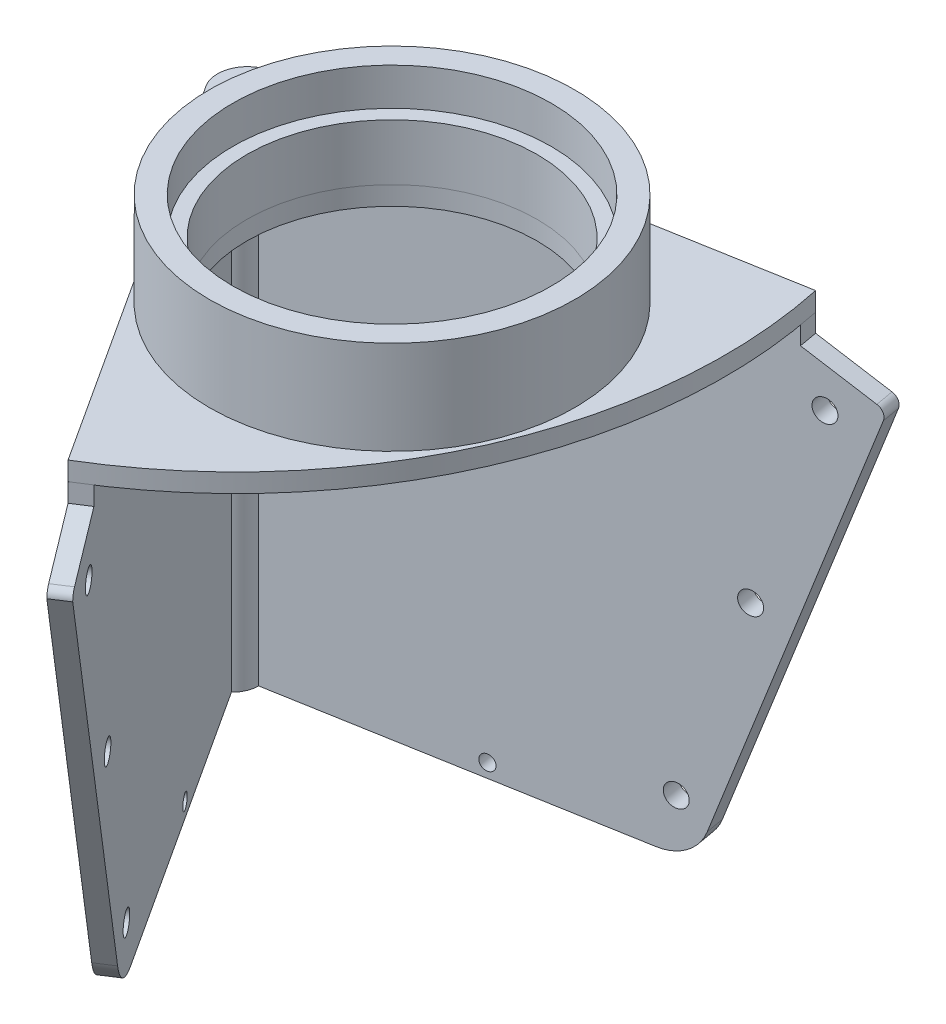
from build123d import *

# Parameters (mm, degrees)
SKETCH1_R           = 0.6
SKETCH1_R_2         = 0.4
BOSS_EXTRUDE2_DEPTH = 1
BOSS_EXTRUDE3_DEPTH = 26.85
SKETCH3_R           = 0.6
SKETCH3_R_2         = 0.4
BOSS_EXTRUDE4_DEPTH = 1
BOSS_EXTRUDE5_DEPTH = 1
SKETCH5_R           = 9.75
SKETCH5_R_2         = 8.5
BOSS_EXTRUDE6_DEPTH = 5
SKETCH5_3_R         = 8.5
SKETCH5_3_R_2       = 7.75
BOSS_EXTRUDE7_DEPTH = 3
CUT_EXTRUDE1_DEPTH  = 3


with BuildPart() as part:
    # Sketch1 → Boss-Extrude2 (new body)
    with BuildSketch(Plane(origin=(3.159090075, 0, 17.916090109), x_dir=(-0.9848077530122081, 0, 0.17364817766693075), z_dir=(-0.17364817766693075, 0, -0.9848077530122081))):
        with BuildLine():
            Line((72.595007279, -13.558180283), (90.945658345, -13.558180283))
            Line((90.945658345, -13.558180283), (90.945658345, -12.058180283))
            Line((90.945658345, -12.058180283), (90.945658345, 13.327413467))
            Line((90.945658345, 13.327413467), (66.945658345, 13.327413467))
            Line((66.945658345, 13.327413467), (65.945658345, 13.327413467))
            Line((65.945658345, 13.327413467), (65.945658345, 12.327413467))
            Line((65.945658345, 12.327413467), (62.421811017, 11.044837929))
            ThreePointArc((62.421811017, 11.044837929), (62.139667195, 10.78630075), (62.122974779, 10.403981547))
            Line((62.122974779, 10.403981547), (70.245775727, -11.913230641))
            ThreePointArc((70.245775727, -11.913230641), (71.161066188, -13.106060393), (72.595007279, -13.558180283))
        make_face()
        with Locations((71.67696085, -10.802896266)):
            Circle(SKETCH1_R, mode=Mode.SUBTRACT)
        with Locations((68.24645728, -0.507107991)):
            Circle(SKETCH1_R, mode=Mode.SUBTRACT)
        with Locations((80.389671463, -12.820376082)):
            Circle(SKETCH1_R_2, mode=Mode.SUBTRACT)
        with Locations((64.81595371, 9.788680284)):
            Circle(SKETCH1_R, mode=Mode.SUBTRACT)
    extrude(amount=BOSS_EXTRUDE2_DEPTH)



with BuildPart() as body_2:
    # Sketch2 → Boss-Extrude3 (new body)
    with BuildSketch(Plane(origin=(0, -13.558180283, 0), x_dir=(-1, 0, 0), z_dir=(0, -1, 0))):
        with BuildLine():
            Line((86.404899366, -33.708637947), (86.404899366, -32.708637947))
            ThreePointArc((86.404899366, -32.708637947), (87.857024455, -33.679090764), (87.576421786, -35.402955053))
            Line((87.576421786, -35.402955053), (86.845068084, -34.720956693))
            ThreePointArc((86.845068084, -34.720956693), (86.519702424, -34.260574933), (86.404899366, -33.708637947))
        make_face()
    extrude(amount=-BOSS_EXTRUDE3_DEPTH)

    # Sketch3 → Boss-Extrude4 (add)
    with BuildSketch(Plane(origin=(-76.943655908, 0, 49.967794395), x_dir=(0.5446390350150253, 0, 0.8386705679454252), z_dir=(-0.8386705679454252, 0, 0.5446390350150253))):
        with BuildLine():
            Line((-18.179769608, -13.558180283), (0.170881459, -13.558180283))
            ThreePointArc((0.170881459, -13.558180283), (1.604822549, -13.106060393), (2.520113011, -11.913230641))
            Line((2.520113011, -11.913230641), (10.673067649, 10.574991619))
            ThreePointArc((10.673067649, 10.574991619), (10.582643671, 10.861779837), (10.34407772, 11.044837929))
            Line((10.34407772, 11.044837929), (6.820230392, 12.327413467))
            Line((6.820230392, 12.327413467), (6.820230392, 13.327413467))
            Line((6.820230392, 13.327413467), (5.820230392, 13.327413467))
            Line((5.820230392, 13.327413467), (-18.179769608, 13.291819717))
            Line((-18.179769608, 13.291819717), (-18.179769608, -13.558180283))
        make_face()
        with Locations((4.338937547, -0.724877435)):
            Circle(SKETCH3_R, mode=Mode.SUBTRACT)
        with Locations((7.769441116, 9.57091084)):
            Circle(SKETCH3_R, mode=Mode.SUBTRACT)
        with Locations((0.908433977, -11.02066571)):
            Circle(SKETCH3_R, mode=Mode.SUBTRACT)
        with Locations((-9.737882362, -12.779880795)):
            Circle(SKETCH3_R_2, mode=Mode.SUBTRACT)
    extrude(amount=BOSS_EXTRUDE4_DEPTH)


with BuildPart() as part_1:
    add(part.part)

    add(body_2.part)  # Boss-Extrude5 merges body 2
    # Sketch4 → Boss-Extrude5 (add)
    with BuildSketch(Plane(origin=(-0.010758081, 13.318752346, -0.016565992), x_dir=(0.9999996737792014, 0.000807737879258443, -1.0046721206054947e-06), z_dir=(-0.0008077385040686105, 0.9999989002492028, -0.0012438082223392647))):
        with BuildLine():
            Line((-74.057030053, -56.248893181), (-87.649206222, -35.318754298))
            ThreePointArc((-87.649206222, -35.318754298), (-87.854314972, -33.716757421), (-86.56778712, -32.740381633))
            Line((-86.56778712, -32.740381633), (-61.947596965, -28.39918055))
            ThreePointArc((-61.947596965, -28.39918055), (-63.536537082, -44.265817075), (-74.057030053, -56.248893181))
        make_face()
    extrude(amount=BOSS_EXTRUDE5_DEPTH)

    # Sketch5 → Boss-Extrude6 (add)
    with BuildSketch(Plane(origin=(-0.011565819, 14.318751246, -0.0178098), x_dir=(0.9999996737792014, 0.0008077378792584431, -1.0046721206054968e-06), z_dir=(-0.0008077385040686106, 0.9999989002492028, -0.0012438082223392654))):
        with Locations(Location((-72.697370565, -40.291844645, 0), (0, 0, 270))):
            Circle(SKETCH5_R)
        with Locations(Location((-72.697370565, -40.291844645, 0), (0, 0, 270))):
            Circle(SKETCH5_R_2, mode=Mode.SUBTRACT)
    extrude(amount=BOSS_EXTRUDE6_DEPTH)

    # Sketch5<4> → Cut-Extrude1 (cut)
    with BuildSketch(Plane(origin=(-0.011565819, 14.318751246, -0.0178098), x_dir=(0.9999996737792014, 0.0008077378792584431, -1.0046721206054968e-06), z_dir=(-0.0008077385040686106, 0.9999989002492028, -0.0012438082223392654))):
        with BuildLine():
            ThreePointArc((-64.947370565, -40.291844645), (-71.122377401, -32.703571025), (-79.807214831, -37.207591979))
            Line((-79.807214831, -37.207591979), (-65.587526299, -43.376097311))
            ThreePointArc((-65.587526299, -43.376097311), (-65.109096945, -41.866837809), (-64.947370565, -40.291844645))
        make_face()
        with BuildLine():
            Line((-65.587526299, -43.376097311), (-79.807214831, -37.207591979))
            ThreePointArc((-79.807214831, -37.207591979), (-75.781623231, -47.401688911), (-65.587526299, -43.376097311))
        make_face()
        with BuildLine():
            ThreePointArc((-64.947370565, -40.291844645), (-71.122377401, -32.703571025), (-79.807214831, -37.207591979))
            Line((-79.807214831, -37.207591979), (-65.587526299, -43.376097311))
            ThreePointArc((-65.587526299, -43.376097311), (-65.109096945, -41.866837809), (-64.947370565, -40.291844645))
        make_face()
        with BuildLine():
            Line((-65.587526299, -43.376097311), (-79.807214831, -37.207591979))
            ThreePointArc((-79.807214831, -37.207591979), (-75.781623231, -47.401688911), (-65.587526299, -43.376097311))
        make_face()
    extrude(amount=-CUT_EXTRUDE1_DEPTH, mode=Mode.SUBTRACT)


with BuildPart() as body_2_2:
    # Sketch5<3> → Boss-Extrude7 (new body)
    with BuildSketch(Plane(origin=(-0.011565819, 14.318751246, -0.0178098), x_dir=(0.9999996737792014, 0.0008077378792584431, -1.0046721206054968e-06), z_dir=(-0.0008077385040686106, 0.9999989002492028, -0.0012438082223392654))):
        with Locations(Location((-72.697370565, -40.291844645, 0), (0, 0, 270))):
            Circle(SKETCH5_3_R)
        with Locations(Location((-72.697370565, -40.291844645, 0), (0, 0, 270))):
            Circle(SKETCH5_3_R_2, mode=Mode.SUBTRACT)
    extrude(amount=BOSS_EXTRUDE7_DEPTH)


solid = Compound([part_1.part, body_2_2.part])
